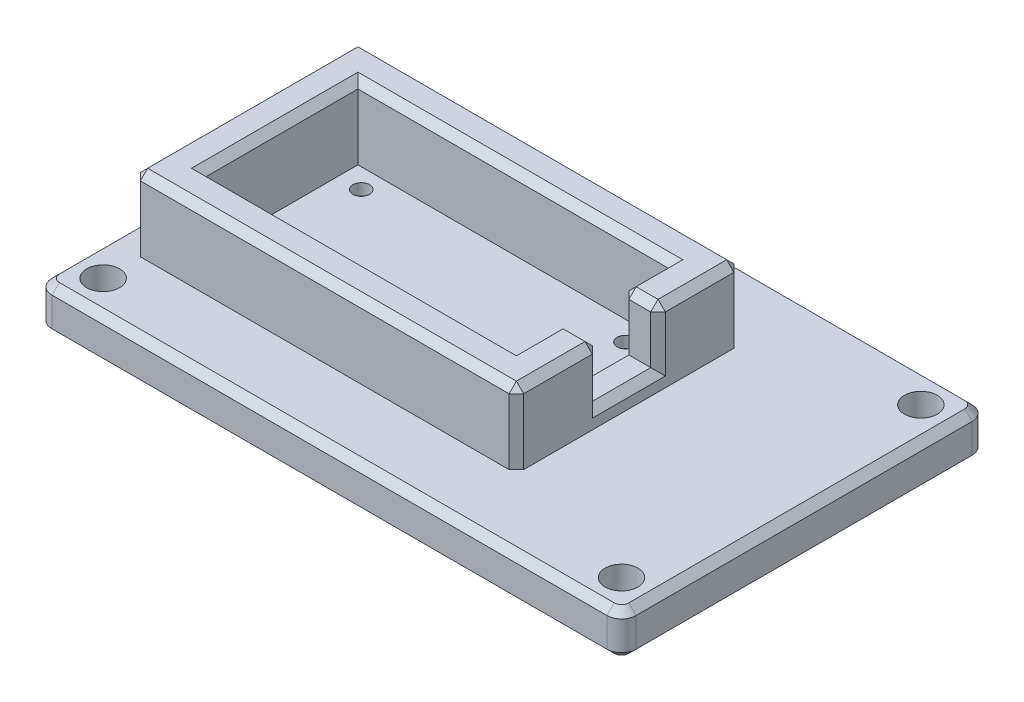
from build123d import *

# Parameters (mm, degrees)
SKETCH1_W           = 80
SKETCH1_H           = 50
BOSS_EXTRUDE1_DEPTH = 6
SKETCH4_W           = 52.5
SKETCH4_H           = 30.8
SKETCH4_W_2         = 42.5
SKETCH4_H_2         = 20.8
BOSS_EXTRUDE2_DEPTH = 10
SKETCH5_W           = 5
SKETCH5_H           = 8
CUT_EXTRUDE1_DEPTH  = 7.6
SKETCH6_R           = 1.15
CUT_EXTRUDE2_DEPTH  = 49.218253805
SKETCH7_R           = 2.1
CUT_EXTRUDE3_DEPTH  = 4.41
CHAMFER3_SIZE       = 1
CHAMFER4_SIZE       = 0.5
SKETCH8_R           = 2.25
CUT_EXTRUDE4_DEPTH  = 49.218253805
FILLET1_R           = 2
CHAMFER5_SIZE       = 1


with BuildPart() as part:
    # Sketch1 → Boss-Extrude1 (new body)
    with BuildSketch(Plane(origin=(0, 0, 0), x_dir=(1, 0, 0), z_dir=(0, 1, 0))):
        Rectangle(SKETCH1_W, SKETCH1_H)
    extrude(amount=BOSS_EXTRUDE1_DEPTH)

    # Sketch4 → Boss-Extrude2 (add)
    with BuildSketch(Plane(origin=(0, 6, 0), x_dir=(1, 0, 0), z_dir=(0, 1, 0))):
        with Locations((-10.25, 0)):
            Rectangle(SKETCH4_W, SKETCH4_H)
        with Locations((-10.25, 0)):
            Rectangle(SKETCH4_W_2, SKETCH4_H_2, mode=Mode.SUBTRACT)
    extrude(amount=BOSS_EXTRUDE2_DEPTH)

    # Sketch5 → Cut-Extrude1 (cut)
    with BuildSketch(Plane(origin=(0, 16, 0), x_dir=(1, 0, 0), z_dir=(0, 1, 0))):
        with Locations((13.5, 0)):
            Rectangle(SKETCH5_W, SKETCH5_H)
    extrude(amount=-CUT_EXTRUDE1_DEPTH, mode=Mode.SUBTRACT)

    # Sketch6 → Cut-Extrude2 (cut, through all)
    with BuildSketch(Plane(origin=(0, 6, 0), x_dir=(1, 0, 0), z_dir=(0, 1, 0))):
        with Locations(Location((-28.35, 7.7, 0), (0, 0, 270))):
            Circle(SKETCH6_R)
        with Locations(Location((7.85, 7.7, 0), (0, 0, 90))):
            Circle(SKETCH6_R)
        with Locations(Location((7.85, -7.7, 0), (0, 0, 270))):
            Circle(SKETCH6_R)
        with Locations(Location((-28.35, -7.7, 0), (0, 0, 90))):
            Circle(SKETCH6_R)
    extrude(amount=-CUT_EXTRUDE2_DEPTH, mode=Mode.SUBTRACT)

    # Sketch7 → Cut-Extrude3 (cut)
    with BuildSketch(Plane.XZ):
        with Locations(Location((-28.35, 7.7, 0), (0, 0, 270))):
            Circle(SKETCH7_R)
        with Locations(Location((7.85, 7.7, 0), (0, 0, 270))):
            Circle(SKETCH7_R)
        with Locations(Location((-28.35, -7.7, 0), (0, 0, 270))):
            Circle(SKETCH7_R)
        with Locations(Location((7.85, -7.7, 0), (0, 0, 270))):
            Circle(SKETCH7_R)
    extrude(amount=-CUT_EXTRUDE3_DEPTH, mode=Mode.SUBTRACT)

    # Chamfer3
    chamfer3_edges = [part.edges().sort_by_distance(p)[0] for p in [
        (16, 16, 9.7),
        (-10.25, 16, -15.4),
        (-36.5, 16, 0),
        (-10.25, 16, 15.4),
        (16, 11, 15.4),
        (16, 11, -15.4),
        (-36.5, 11, -15.4),
        (-36.5, 11, 15.4),
        (11, 16, 7.2),
        (-10.25, 16, -10.4),
        (-31.5, 16, 0),
        (-10.25, 16, 10.4),
        (11, 16, -7.2),
        (16, 16, -9.7),
        (16, 8.4, 0),
        (16, 12.2, -4),
        (16, 12.2, 4),
        (11, 8.4, 0),
        (11, 12.2, 4),
        (11, 12.2, -4),
        (13.5, 16, -4),
        (13.5, 16, 4),
    ]]
    chamfer(chamfer3_edges, length=CHAMFER3_SIZE)

    # Chamfer4
    chamfer4_edges = [part.edges().sort_by_distance(p)[0] for p in [
        (7.85, 0, 9.8),
        (-28.35, 0, -5.6),
        (7.85, 0, -5.6),
        (-28.35, 0, 9.8),
    ]]
    chamfer(chamfer4_edges, length=CHAMFER4_SIZE)

    # Sketch8 → Cut-Extrude4 (cut, through all)
    with BuildSketch(Plane(origin=(0, 6, 0), x_dir=(1, 0, 0), z_dir=(0, 1, 0))):
        with Locations(Location((-35.5, 20.5, 0), (0, 0, 270))):
            Circle(SKETCH8_R)
        with Locations(Location((35.5, 20.5, 0), (0, 0, 270))):
            Circle(SKETCH8_R)
        with Locations(Location((35.5, -20.5, 0), (0, 0, 270))):
            Circle(SKETCH8_R)
        with Locations(Location((-35.5, -20.5, 0), (0, 0, 270))):
            Circle(SKETCH8_R)
    extrude(amount=-CUT_EXTRUDE4_DEPTH, mode=Mode.SUBTRACT)

    # Fillet1
    fillet1_edges = [part.edges().sort_by_distance(p)[0] for p in [
        (40, 3, 25),
        (-40, 3, 25),
        (-40, 3, -25),
        (40, 3, -25),
    ]]
    fillet(fillet1_edges, radius=FILLET1_R)

    # Chamfer5
    chamfer5_edges = [part.edges().sort_by_distance(p)[0] for p in [
        (-40, 0, 0),
        (-40, 6, 0),
        (40, 0, 0),
        (0, 0, 25),
        (0, 0, -25),
        (-39.414213562, 0, 24.414213562),
        (39.414213562, 0, 24.414213562),
        (39.414213562, 0, -24.414213562),
        (-39.414213562, 0, -24.414213562),
        (0, 6, -25),
        (40, 6, 0),
        (0, 6, 25),
        (-39.414213562, 6, 24.414213562),
        (39.414213562, 6, 24.414213562),
        (39.414213562, 6, -24.414213562),
        (-39.414213562, 6, -24.414213562),
    ]]
    chamfer(chamfer5_edges, length=CHAMFER5_SIZE)


solid = part.part
